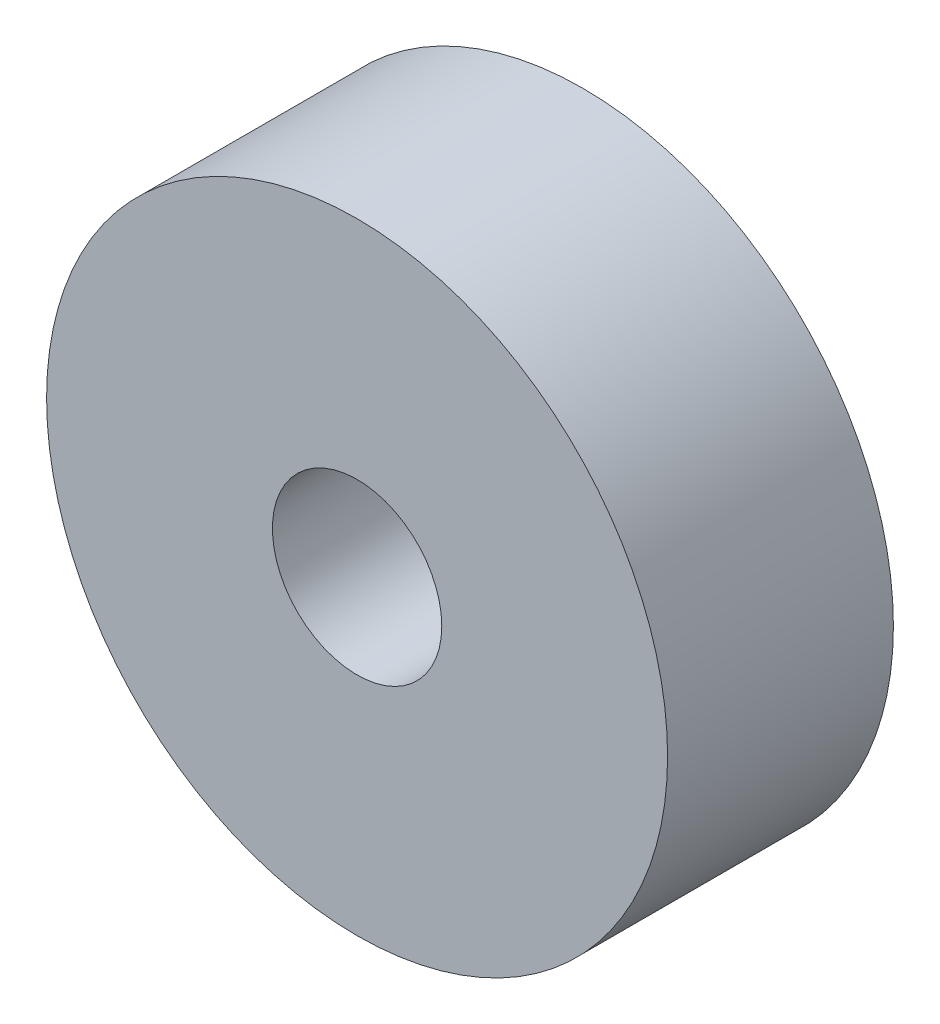
from build123d import *

# Parameters (mm, degrees)
SKETCH1_R           = 8.73125
SKETCH1_R_2         = 2.38125
BOSS_EXTRUDE1_DEPTH = 6.35


with BuildPart() as part:
    # Sketch1 → Boss-Extrude1 (new body)
    with BuildSketch(Plane.XY):
        Circle(SKETCH1_R)
        Circle(SKETCH1_R_2, mode=Mode.SUBTRACT)
    extrude(amount=BOSS_EXTRUDE1_DEPTH)


solid = part.part
